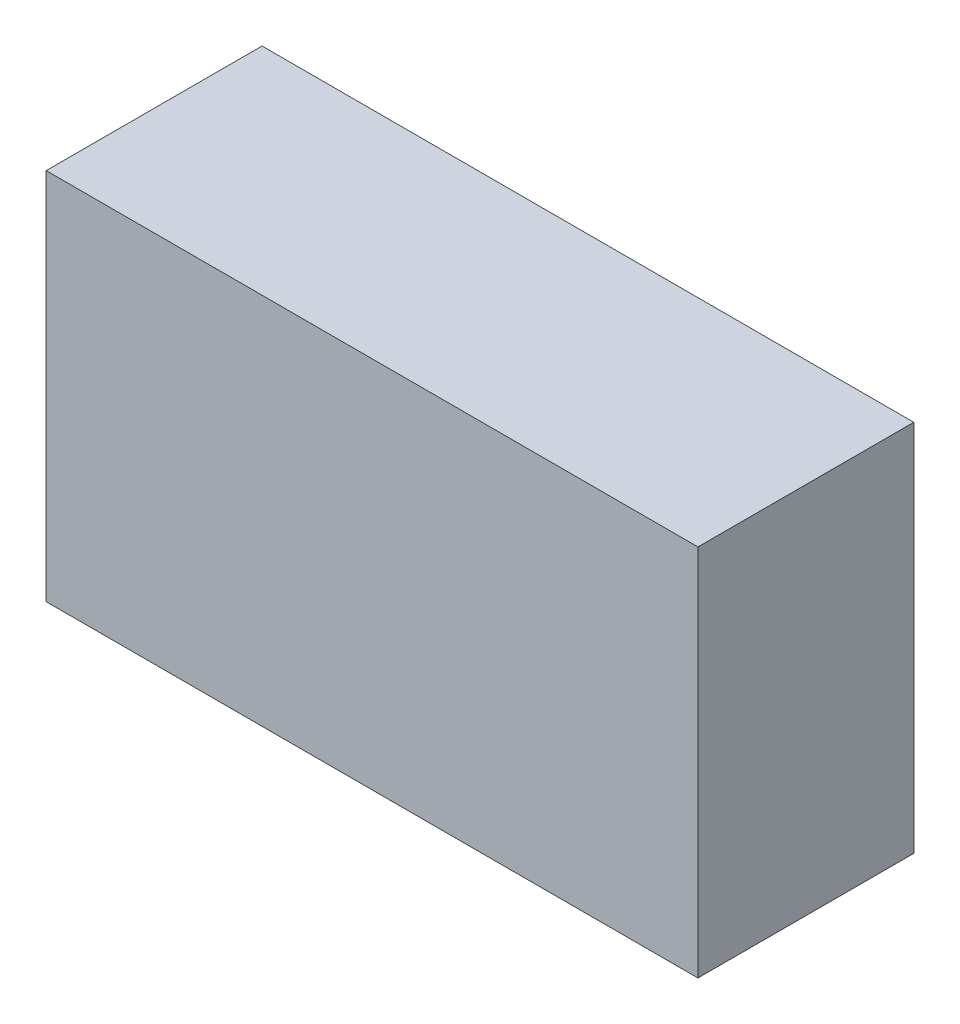
from build123d import *

# Parameters (mm, degrees)
SKETCH1_W                 = 21.89230149
SKETCH1_H                 = 12.54
BOSS_EXTRUDE1_DEPTH       = 7.25
SHELL1_T                  = -0.5
SHELL1_THICKNESS_2_FACE_W = 20.89230149
SHELL1_THICKNESS_2_FACE_H = 11.54
SHELL1_THICKNESS_2_DEPTH  = 0.3


with BuildPart() as part:
    # Sketch1 → Boss-Extrude1 (new body)
    with BuildSketch(Plane.XY):
        with Locations((68.090650745, 23.92)):
            Rectangle(SKETCH1_W, SKETCH1_H)
    extrude(amount=BOSS_EXTRUDE1_DEPTH)

    # Shell1
    shell1_openings = [part.faces().sort_by_distance(p)[0] for p in [
        (68.090650745, 23.92, 0),
    ]]
    offset(amount=SHELL1_T, openings=shell1_openings, kind=Kind.INTERSECTION)

    # Shell1 thickness 2 face (on inner face of the shell) → Shell1 thickness 2 (cut)
    with BuildSketch(Plane(origin=(68.090650745, 23.92, 6.75), x_dir=(1, 0, 0), z_dir=(0, 0, 1))):
        Rectangle(SHELL1_THICKNESS_2_FACE_W, SHELL1_THICKNESS_2_FACE_H)
    extrude(amount=SHELL1_THICKNESS_2_DEPTH, mode=Mode.SUBTRACT)


solid = part.part
